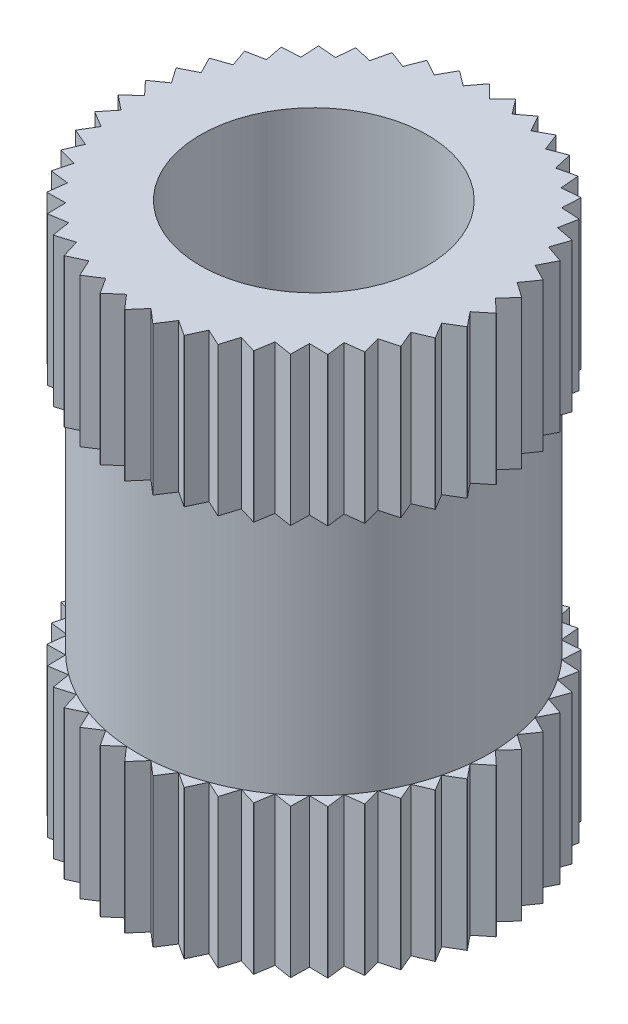
from build123d import *

# Parameters (mm, degrees)
CUT_EXTRUDE1_DEPTH    = 12.157956802
CIRPATTERN1_COUNT     = 45
M5X0_8_TAPPED_HOLE1_D = 4.2


with BuildPart() as part:
    # Sketch1 → Revolve1 (revolve)
    with BuildSketch(Plane.XY, mode=Mode.PRIVATE) as revolve1_sk:
        Polygon((0, 0), (0, 10), (-3.5, 10), (-3.5, 7.25), (-3.25, 7.25), (-3.25, 2.75), (-3.5, 2.75), (-3.5, 0), align=None)
    revolve(revolve1_sk.sketch.rotate(Axis((0, 0, 0), (0, 1, 0)), 270), axis=Axis((0, 0, 0), (0, 1, 0)))

    # Sketch2 → Cut-Extrude1 (cut, through all)
    with BuildSketch(Plane(origin=(0, 10, 0), x_dir=(1, 0, 0), z_dir=(0, 1, 0))):
        Polygon((-18.527266507, 21.777266507), (-0.241648065, 3.491648065), (0, 3.25), (0.241648065, 3.491648065), (18.527266507, 21.777266507), (18.527266507, 73.496805701), (-18.527266507, 73.496805701), align=None)
    cut_extrude1 = extrude(amount=-CUT_EXTRUDE1_DEPTH, mode=Mode.SUBTRACT)

    # CirPattern1: Cut-Extrude1 ×45 about axis
    cirpattern1_axis = Axis((0, 0, 0), (0, 1, 0))
    for i in range(1, CIRPATTERN1_COUNT):
        add(cut_extrude1.rotate(cirpattern1_axis, i * 360 / CIRPATTERN1_COUNT), mode=Mode.SUBTRACT)

    # M5x0.8 Tapped Hole1 (through all)
    with Locations(Plane(origin=(0, 10, 0), x_dir=(1, 0, 0), z_dir=(0, 1, 0))):
        with Locations((0, 0)):
            Hole(M5X0_8_TAPPED_HOLE1_D / 2)


solid = part.part
